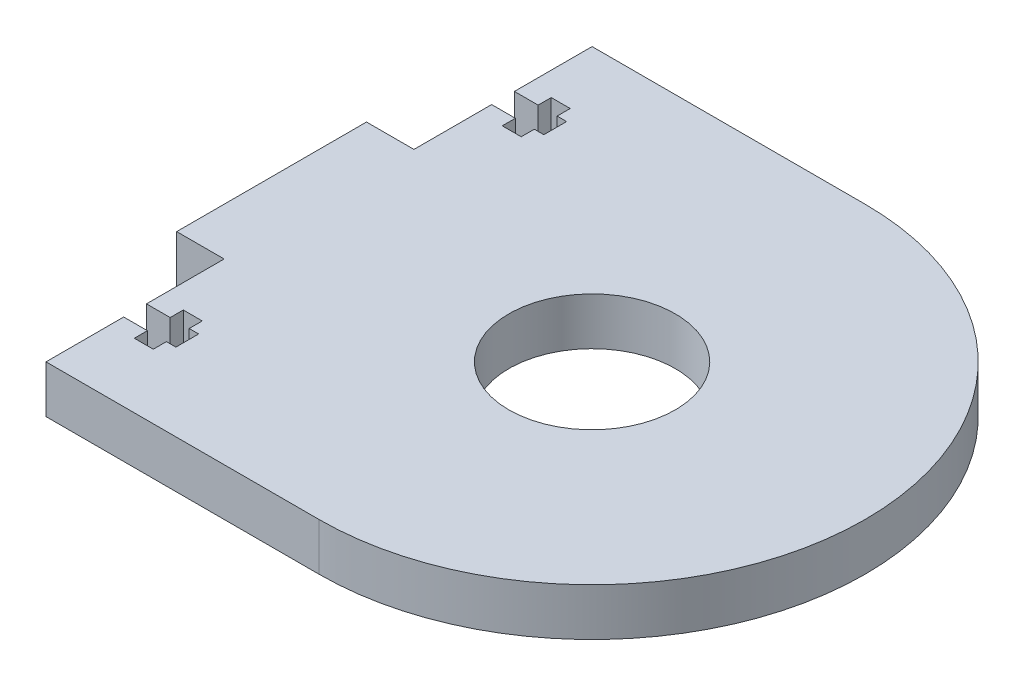
from build123d import *

# Parameters (mm, degrees)
SKETCH1_R           = 11.1379
BOSS_EXTRUDE1_DEPTH = 6.35


with BuildPart() as part:
    # Sketch1 → Boss-Extrude1 (new body)
    with BuildSketch(Plane(origin=(0, 0, 0), x_dir=(1, 0, 0), z_dir=(0, 1, 0))):
        with BuildLine():
            Line((-34.169803213, 12.296548394), (-40.519803213, 12.296548394))
            Line((-40.519803213, 12.296548394), (-40.519803213, -13.103451606))
            Line((-40.519803213, -13.103451606), (-34.169803213, -13.103451606))
            Line((-34.169803213, -13.103451606), (-34.169803213, -23.498436767))
            Line((-34.169803213, -23.498436767), (-30.994803213, -23.498436767))
            Line((-30.994803213, -23.498436767), (-30.994803213, -21.745836767))
            Line((-30.994803213, -21.745836767), (-28.454803213, -21.745836767))
            Line((-28.454803213, -21.745836767), (-28.454803213, -23.498436767))
            Line((-28.454803213, -23.498436767), (-27.184803213, -23.498436767))
            Line((-27.184803213, -23.498436767), (-27.184803213, -26.546296123))
            Line((-27.184803213, -26.546296123), (-28.454803213, -26.546296123))
            Line((-28.454803213, -26.546296123), (-28.454803213, -28.298896123))
            Line((-28.454803213, -28.298896123), (-30.994803213, -28.298896123))
            Line((-30.994803213, -28.298896123), (-30.994803213, -26.546296123))
            Line((-30.994803213, -26.546296123), (-34.169803213, -26.546296123))
            Line((-34.169803213, -26.546296123), (-34.169803213, -36.941351606))
            Line((-34.169803213, -36.941351606), (2.368096787, -36.941351606))
            ThreePointArc((2.368096787, -36.941351606), (38.905996787, -0.403451606), (2.368096787, 36.134448394))
            Line((2.368096787, 36.134448394), (-34.169803213, 36.134448394))
            Line((-34.169803213, 36.134448394), (-34.169803213, 25.739463233))
            Line((-34.169803213, 25.739463233), (-30.994803213, 25.739463233))
            Line((-30.994803213, 25.739463233), (-30.994803213, 27.492063233))
            Line((-30.994803213, 27.492063233), (-28.454803213, 27.492063233))
            Line((-28.454803213, 27.492063233), (-28.454803213, 25.739463233))
            Line((-28.454803213, 25.739463233), (-27.184803213, 25.739463233))
            Line((-27.184803213, 25.739463233), (-27.184803213, 22.691603877))
            Line((-27.184803213, 22.691603877), (-28.454803213, 22.691603877))
            Line((-28.454803213, 22.691603877), (-28.454803213, 20.939003877))
            Line((-28.454803213, 20.939003877), (-30.994803213, 20.939003877))
            Line((-30.994803213, 20.939003877), (-30.994803213, 22.691603877))
            Line((-30.994803213, 22.691603877), (-34.169803213, 22.691603877))
            Line((-34.169803213, 22.691603877), (-34.169803213, 12.296548394))
        make_face()
        with Locations(Location((2.368096787, -0.403451606, 0), (0, 0, 270))):
            Circle(SKETCH1_R, mode=Mode.SUBTRACT)
    extrude(amount=BOSS_EXTRUDE1_DEPTH)


solid = part.part
